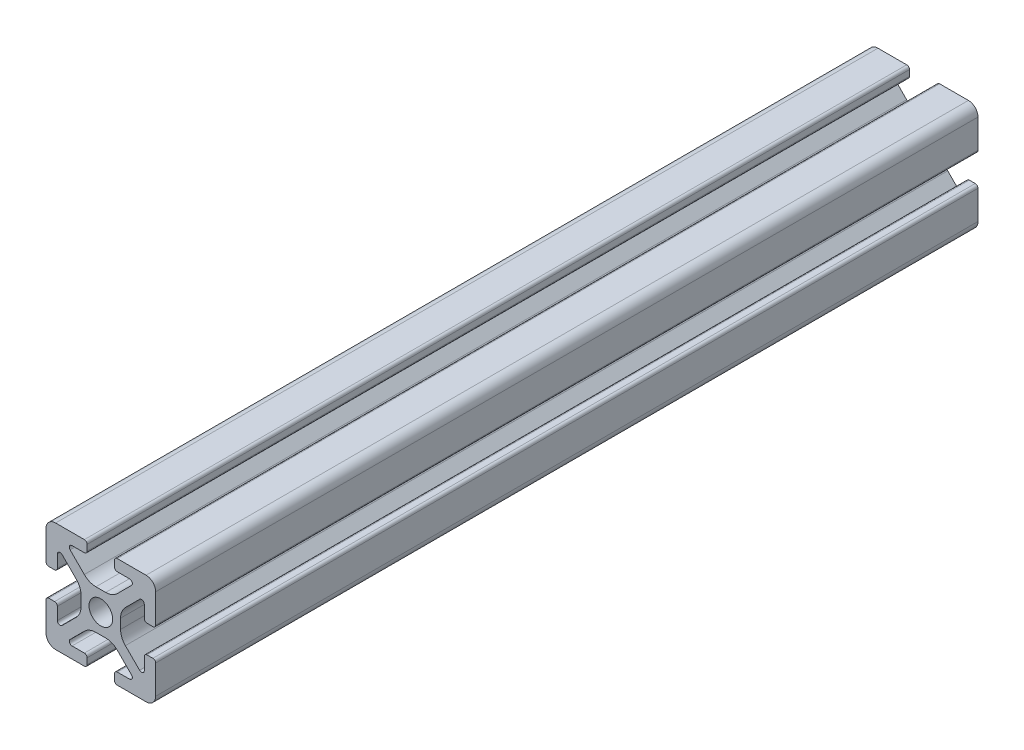
from build123d import *

# Parameters (mm, degrees)
BOSS_EXTRUDE1_DEPTH = 75


with BuildPart() as part:
    # Sketch4 → Boss-Extrude1 (new, symmetric)
    with BuildSketch(Plane.XY):
        with BuildLine():
            Line((3, -10), (8.25, -10))
            ThreePointArc((8.25, -10), (9.487436867, -9.487436867), (10, -8.25))
            Line((10, -8.25), (10, -3))
            ThreePointArc((10, -3), (9.853553391, -2.646446609), (9.5, -2.5))
            Line((9.5, -2.5), (8.424621202, -2.5))
            ThreePointArc((8.424621202, -2.5), (8.071067812, -2.646446609), (7.924621202, -3))
            Line((7.924621202, -3), (7.924621202, -5.25))
            ThreePointArc((7.924621202, -5.25), (7.615962919, -5.711939766), (7.071067812, -5.603553391))
            Line((7.071067812, -5.603553391), (4.478679656, -3.011165235))
            ThreePointArc((4.478679656, -3.011165235), (3.828361402, -2.037895189), (3.6, -0.889844892))
            Line((3.6, -0.889844892), (3.6, 0))
            Line((3.6, 0), (2.15, 0))
            ThreePointArc((2.15, 0), (1.52027958, -1.52027958), (0, -2.15))
            Line((0, -2.15), (0, -3.6))
            Line((0, -3.6), (0.889844892, -3.6))
            ThreePointArc((0.889844892, -3.6), (2.037895189, -3.828361402), (3.011165235, -4.478679656))
            Line((3.011165235, -4.478679656), (5.603553391, -7.071067812))
            ThreePointArc((5.603553391, -7.071067812), (5.711939766, -7.615962919), (5.25, -7.924621202))
            Line((5.25, -7.924621202), (3, -7.924621202))
            ThreePointArc((3, -7.924621202), (2.646446609, -8.071067812), (2.5, -8.424621202))
            Line((2.5, -8.424621202), (2.5, -9.5))
            ThreePointArc((2.5, -9.5), (2.646446609, -9.853553391), (3, -10))
        make_face()
    extrude(amount=BOSS_EXTRUDE1_DEPTH, both=True)

    # Mirror1: part across plane


with BuildPart() as part_1:
    add(part.part)
    add(part.part.mirror(Plane(origin=(0, 0, 0), x_dir=(0, 0, 1), z_dir=(1, 0, 0))))

    # Mirror2: part across plane


with BuildPart() as part_2:
    add(part_1.part)
    add(part_1.part.mirror(Plane.ZX))


solid = part_2.part
